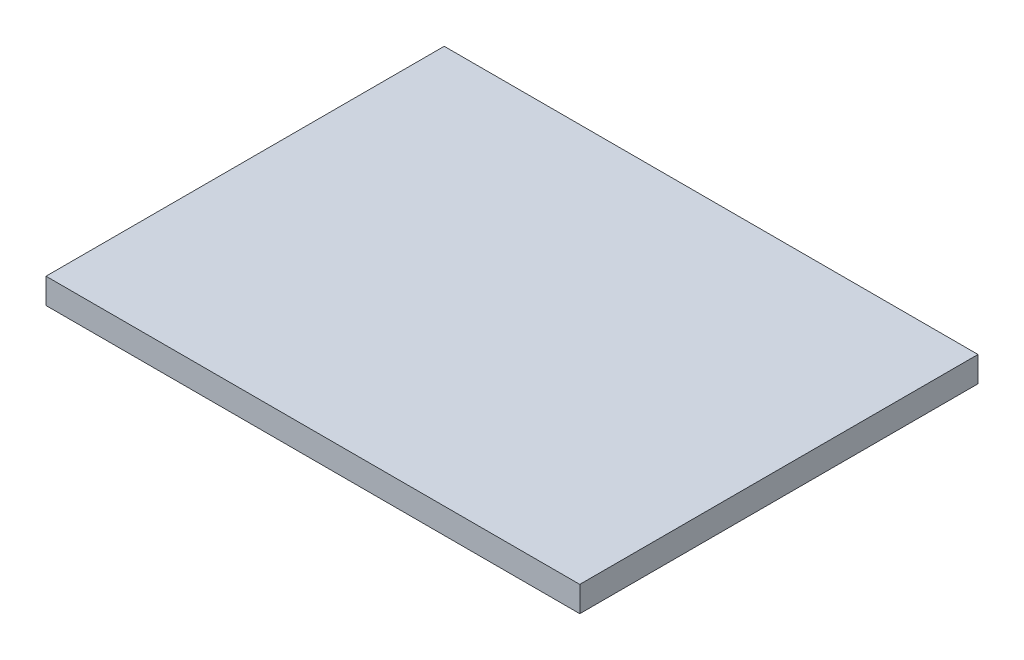
from build123d import *

# Parameters (mm, degrees)
SKETCH1_W           = 630
SKETCH1_H           = 470
BOSS_EXTRUDE1_DEPTH = 30


with BuildPart() as part:
    # Sketch1 → Boss-Extrude1 (new body)
    with BuildSketch(Plane(origin=(0, 0, 0), x_dir=(1, 0, 0), z_dir=(0, 1, 0))):
        Rectangle(SKETCH1_W, SKETCH1_H)
    extrude(amount=BOSS_EXTRUDE1_DEPTH)


solid = part.part
